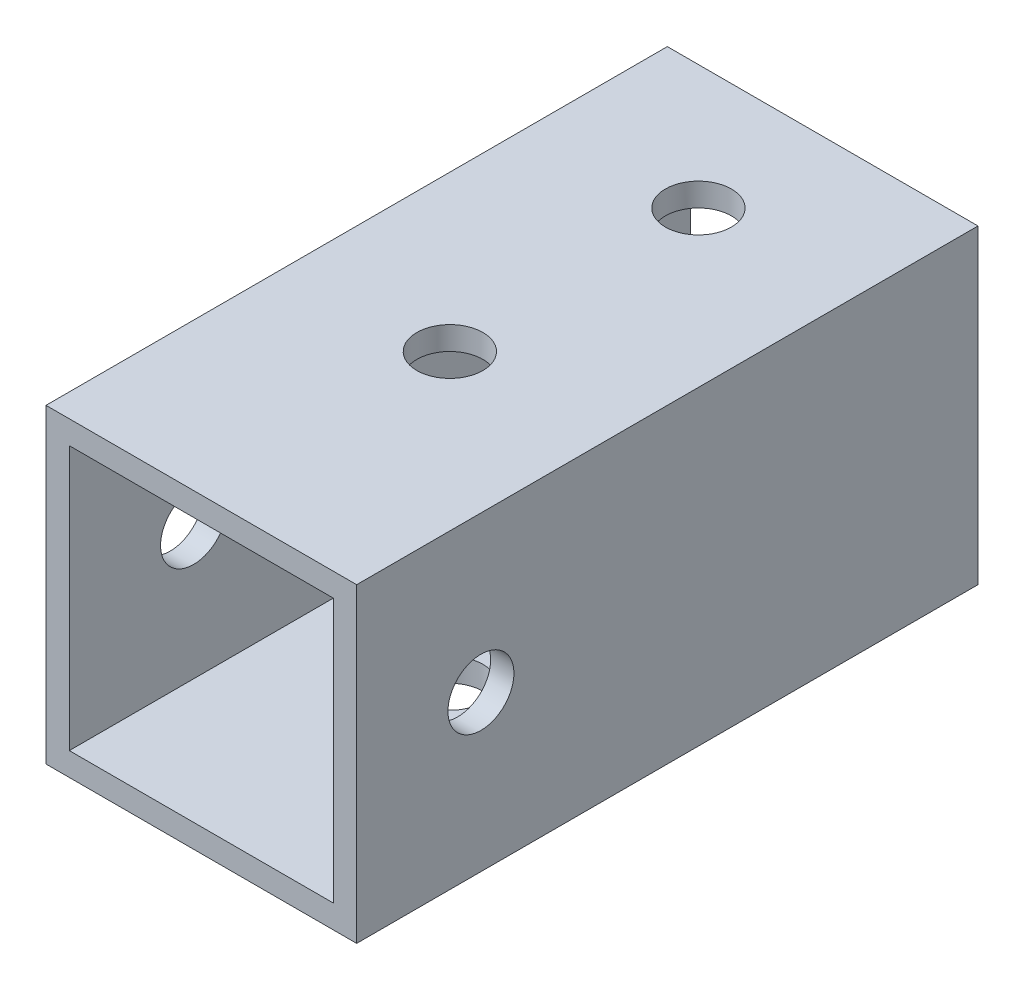
from build123d import *

# Parameters (mm, degrees)
SKETCH1_W           = 20
SKETCH1_H           = 20
SKETCH1_W_2         = 17
SKETCH1_H_2         = 17
BOSS_EXTRUDE1_DEPTH = 40
SKETCH2_R           = 2.125
CUT_EXTRUDE1_DEPTH  = 46.82575695
SKETCH3_R           = 2.125
CUT_EXTRUDE2_DEPTH  = 46.82575695


with BuildPart() as part:
    # Sketch1 → Boss-Extrude1 (new body)
    with BuildSketch(Plane.XY):
        Rectangle(SKETCH1_W, SKETCH1_H)
        Rectangle(SKETCH1_W_2, SKETCH1_H_2, mode=Mode.SUBTRACT)
    extrude(amount=-BOSS_EXTRUDE1_DEPTH)

    # Sketch2 → Cut-Extrude1 (cut, through all)
    with BuildSketch(Plane(origin=(0, 10, 0), x_dir=(1, 0, 0), z_dir=(0, 1, 0))):
        with Locations(Location((0, 32, 0), (0, 0, 90))):
            Circle(SKETCH2_R)
        with Locations(Location((0, 16, 0), (0, 0, 270))):
            Circle(SKETCH2_R)
    extrude(amount=-CUT_EXTRUDE1_DEPTH, mode=Mode.SUBTRACT)

    # Sketch3 → Cut-Extrude2 (cut, through all)
    with BuildSketch(Plane(origin=(10, 0, 0), x_dir=(0, 0, -1), z_dir=(1, 0, 0))):
        with Locations((8, 0)):
            Circle(SKETCH3_R)
    extrude(amount=-CUT_EXTRUDE2_DEPTH, mode=Mode.SUBTRACT)


solid = part.part
